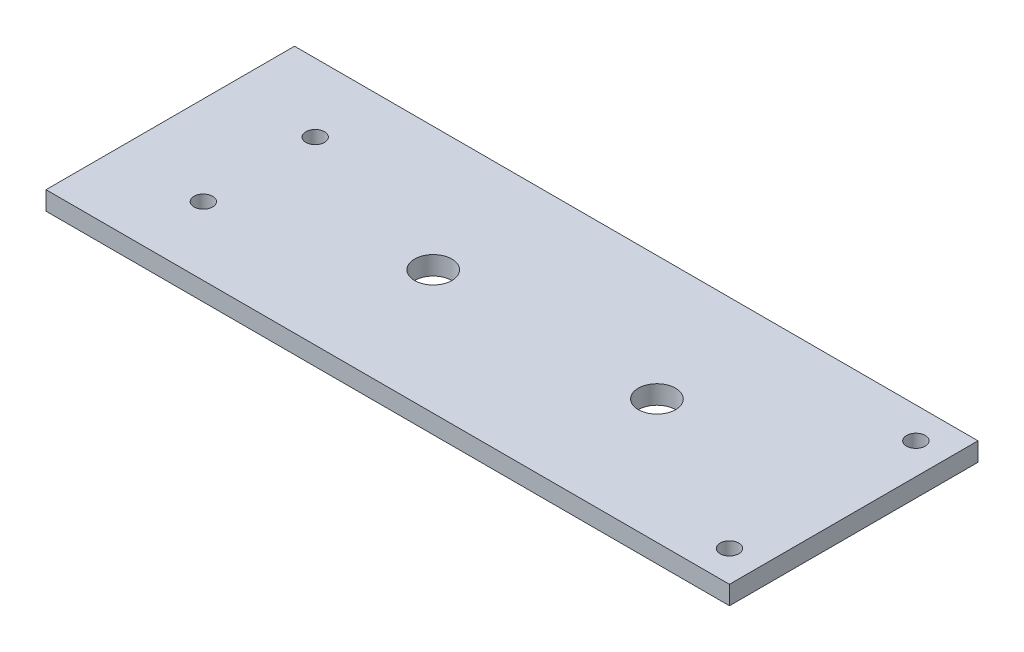
from build123d import *

# Parameters (mm, degrees)
SKETCH1_W           = 110
SKETCH1_H           = 40
SKETCH1_R           = 1.5
BOSS_EXTRUDE1_DEPTH = 3
SKETCH1_6_R         = 3
CUT_EXTRUDE2_DEPTH  = 16


with BuildPart() as part:
    # Sketch1 → Boss-Extrude1 (new body)
    with BuildSketch(Plane(origin=(0, 0, 0), x_dir=(1, 0, 0), z_dir=(0, 1, 0))):
        with Locations((-55, 20)):
            Rectangle(SKETCH1_W, SKETCH1_H)
        with Locations((-95.675, 11)):
            Circle(SKETCH1_R, mode=Mode.SUBTRACT)
        with Locations((-5, 5)):
            Circle(SKETCH1_R, mode=Mode.SUBTRACT)
        with Locations((-5, 35)):
            Circle(SKETCH1_R, mode=Mode.SUBTRACT)
        with Locations((-95.675, 29)):
            Circle(SKETCH1_R, mode=Mode.SUBTRACT)
    extrude(amount=BOSS_EXTRUDE1_DEPTH)

    # Sketch1<6> → Cut-Extrude2 (cut)
    with BuildSketch(Plane(origin=(0, 0, 0), x_dir=(1, 0, 0), z_dir=(0, 1, 0))):
        with Locations((-31.675, 20)):
            Circle(SKETCH1_6_R)
        with Locations((-67.675, 20)):
            Circle(SKETCH1_6_R)
    extrude(amount=CUT_EXTRUDE2_DEPTH, mode=Mode.SUBTRACT)


solid = part.part
